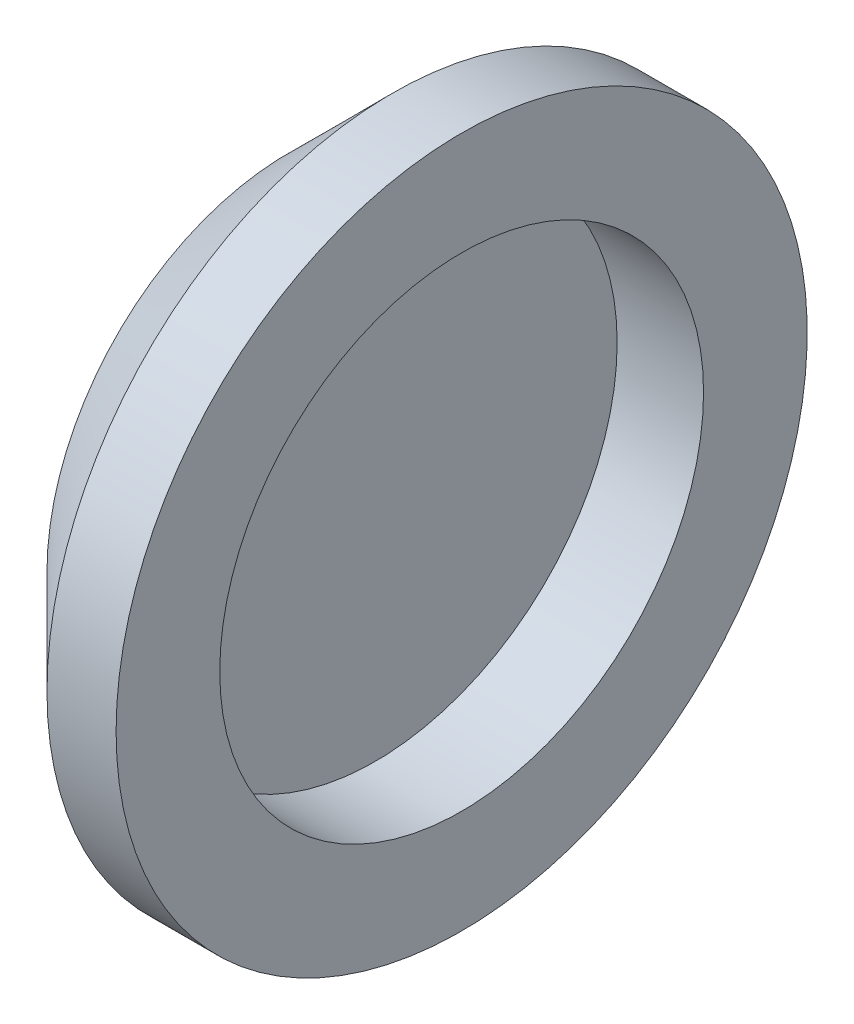
from build123d import *

# Parameters (mm, degrees)
SKETCH2_R          = 3.556
CUT_EXTRUDE1_DEPTH = 1.27


with BuildPart() as part:
    # Sketch1 → Revolve1 (revolve)
    with BuildSketch(Plane.XY, mode=Mode.PRIVATE) as revolve1_sk:
        Polygon((0, 0), (0, 5.08), (-1.016, 5.08), (-2.54, 3.556), (-2.54, 0), align=None)
    revolve(revolve1_sk.sketch.rotate(Axis((-2.54, 0, 0), (1, 0, 0)), 90), axis=Axis((-2.54, 0, 0), (1, 0, 0)))

    # Sketch2 → Cut-Extrude1 (cut)
    with BuildSketch(Plane(origin=(0, 0, 0), x_dir=(0, 0, -1), z_dir=(1, 0, 0))):
        Circle(SKETCH2_R)
    extrude(amount=-CUT_EXTRUDE1_DEPTH, mode=Mode.SUBTRACT)


solid = part.part
